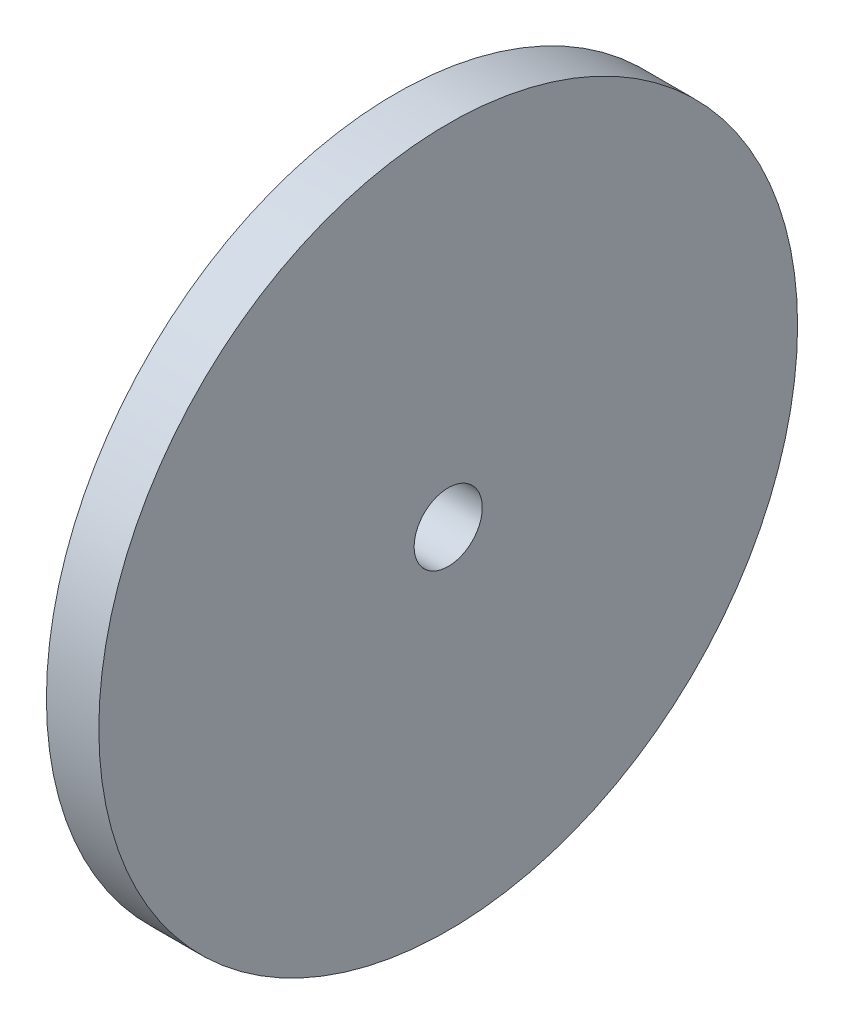
from build123d import *

# Parameters (mm, degrees)
SKETCH1_W = 1.5
SKETCH1_H = 9.025


with BuildPart() as part:
    # Sketch1 → Revolve1 (revolve)
    with BuildSketch(Plane.XY, mode=Mode.PRIVATE) as revolve1_sk:
        with Locations((0, 5.4875)):
            Rectangle(SKETCH1_W, SKETCH1_H)
    revolve(revolve1_sk.sketch.rotate(Axis((-0.75, 0, 0), (1, 0, 0)), 90), axis=Axis((-0.75, 0, 0), (1, 0, 0)))


solid = part.part
